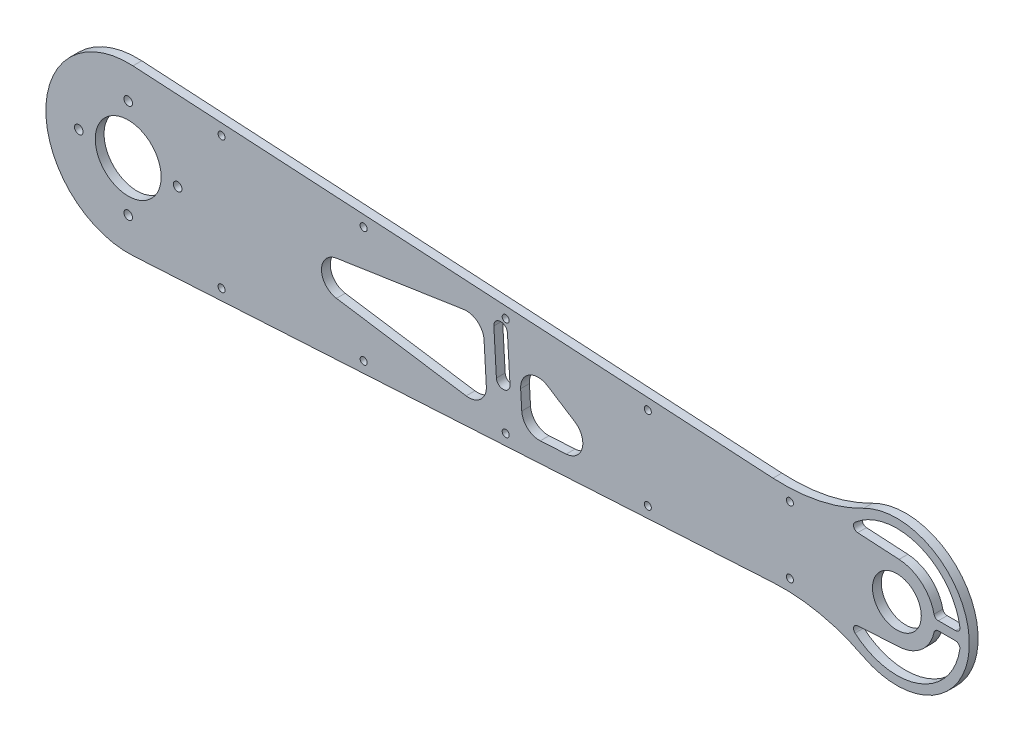
from build123d import *

# Parameters (mm, degrees)
SKETCH1_R              = 11.1125
SKETCH1_R_2            = 15
SKETCH1_R_3            = 1.6
BOSS_EXTRUDE1_DEPTH    = 4
M3_5_CLEARANCE_HOLE1_D = 3.9
CUT_EXTRUDE1_DEPTH     = 10
BOSS_EXTRUDE2_START    = -4
BOSS_EXTRUDE2_DEPTH    = 4
FILLET1_R              = 2
FILLET2_R              = 80


with BuildPart() as part:
    # Sketch1 → Boss-Extrude1 (new body)
    with BuildSketch(Plane.XY):
        with BuildLine():
            Line((-172.834121622, 37.437400696), (175.998333346, 17.256280804))
            ThreePointArc((175.998333346, 17.256280804), (192.285135135, 0), (175.998333346, -17.256280804))
            Line((175.998333346, -17.256280804), (-172.834121622, -37.437400696))
            ThreePointArc((-172.834121622, -37.437400696), (-212.5, 0), (-172.834121622, 37.437400696))
        make_face()
        with Locations((175, 0)):
            Circle(SKETCH1_R, mode=Mode.SUBTRACT)
        with Locations((-175, 0)):
            Circle(SKETCH1_R_2, mode=Mode.SUBTRACT)
        with Locations((-132.5, 30.095576829)):
            Circle(SKETCH1_R_3, mode=Mode.SUBTRACT)
        with Locations((-67.805059302, 26.352758935)):
            Circle(SKETCH1_R_3, mode=Mode.SUBTRACT)
        with Locations((-3.110118604, 22.60994104)):
            Circle(SKETCH1_R_3, mode=Mode.SUBTRACT)
        with Locations((61.584822094, 18.867123146)):
            Circle(SKETCH1_R_3, mode=Mode.SUBTRACT)
        with Locations((126.279762792, 15.124305251)):
            Circle(SKETCH1_R_3, mode=Mode.SUBTRACT)
        with Locations(Location((126.279762792, -15.124305251, 0), (0, 0, 180))):
            Circle(SKETCH1_R_3, mode=Mode.SUBTRACT)
        with Locations(Location((61.584822094, -18.867123146, 0), (0, 0, 180))):
            Circle(SKETCH1_R_3, mode=Mode.SUBTRACT)
        with Locations(Location((-3.110118604, -22.60994104, 0), (0, 0, 180))):
            Circle(SKETCH1_R_3, mode=Mode.SUBTRACT)
        with Locations(Location((-67.805059302, -26.352758935, 0), (0, 0, 180))):
            Circle(SKETCH1_R_3, mode=Mode.SUBTRACT)
        with Locations(Location((-132.5, -30.095576829, 0), (0, 0, 180))):
            Circle(SKETCH1_R_3, mode=Mode.SUBTRACT)
    extrude(amount=BOSS_EXTRUDE1_DEPTH)

    # M3.5 Clearance Hole1 (through all)
    with Locations(Plane.XY.offset(4)):
        with Locations((-197.5, 0), (-175, 22.5), (-152.5, 0), (-175, -22.5)):
            Hole(M3_5_CLEARANCE_HOLE1_D / 2)

    # Sketch7 → Cut-Extrude1 (cut)
    with BuildSketch(Plane.XY.offset(4)):
        with BuildLine():
            Line((15.991284585, 5.612221232), (28.312344657, -2.287027054))
            ThreePointArc((28.312344657, -2.287027054), (31.73354052, -11.048707916), (24.456630921, -17.008424298))
            Line((24.456630921, -17.008424298), (12.632145333, -17.692510191))
            ThreePointArc((12.632145333, -17.692510191), (6.849401654, -15.679997443), (4.183445797, -10.167918763))
            Line((4.183445797, -10.167918763), (3.686871313, -1.584584585))
            ThreePointArc((3.686871313, -1.584584585), (7.634498428, 5.782998459), (15.991284585, 5.612221232))
        make_face()
        with BuildLine():
            Line((-11.941116444, -8.477289375), (-12.966479952, 9.246210209))
            ThreePointArc((-12.966479952, 9.246210209), (-15.914080917, 14.997692214), (-22.150280177, 16.694075277))
            Line((-22.150280177, 16.694075277), (-80.189531309, 7.909919122))
            ThreePointArc((-80.189531309, 7.909919122), (-86.992376567, 0), (-80.189531309, -7.909919122))
            Line((-80.189531309, -7.909919122), (-21.124916668, -16.849262551))
            ThreePointArc((-21.124916668, -16.849262551), (-14.538255469, -14.851468272), (-11.941116444, -8.477289375))
        make_face()
        with BuildLine():
            Line((-7.35411028, -2.925540775), (-8.509245415, 17.04107293))
            ThreePointArc((-8.509245415, 17.04107293), (-5.593466237, 20.314944), (-2.319595167, 17.399164822))
            Line((-2.319595167, 17.399164822), (-1.164460032, -2.567448883))
            ThreePointArc((-1.164460032, -2.567448883), (-4.08023921, -5.841319953), (-7.35411028, -2.925540775))
        make_face()
    extrude(amount=-CUT_EXTRUDE1_DEPTH, mode=Mode.SUBTRACT)

    # Sketch9 → Boss-Extrude2 (add)
    with BuildSketch(Plane.XY.offset(4).offset(BOSS_EXTRUDE2_START)):
        with BuildLine():
            Line((192.169038897, 2), (203.930952283, 2))
            ThreePointArc((203.930952283, 2), (183.947829075, 27.585074857), (152.751498531, 18.60118766))
            Line((152.751498531, 18.60118766), (147.934334346, 18.87987666))
            ThreePointArc((147.934334346, 18.87987666), (208, 0), (147.934334346, -18.87987666))
            Line((147.934334346, -18.87987666), (152.751498531, -18.60118766))
            ThreePointArc((152.751498531, -18.60118766), (183.947829075, -27.585074857), (203.930952283, -2))
            Line((203.930952283, -2), (192.169038897, -2))
            ThreePointArc((192.169038897, -2), (192.285135135, 0), (192.169038897, 2))
        make_face()
    extrude(amount=BOSS_EXTRUDE2_DEPTH)

    # Fillet1
    fillet1_edges = [part.edges().sort_by_distance(p)[0] for p in [
        (192.169038897, 2, 2),
        (192.169038897, -2, 2),
        (203.930952283, -2, 2),
        (152.751498531, -18.60118766, 2),
        (152.751498531, 18.60118766, 2),
        (203.930952283, 2, 2),
    ]]
    fillet(fillet1_edges, radius=FILLET1_R)

    # Fillet2
    fillet2_edges = [part.edges().sort_by_distance(p)[0] for p in [
        (147.934334346, -18.87987666, 2),
        (147.934334346, 18.87987666, 2),
    ]]
    fillet(fillet2_edges, radius=FILLET2_R)


solid = part.part
